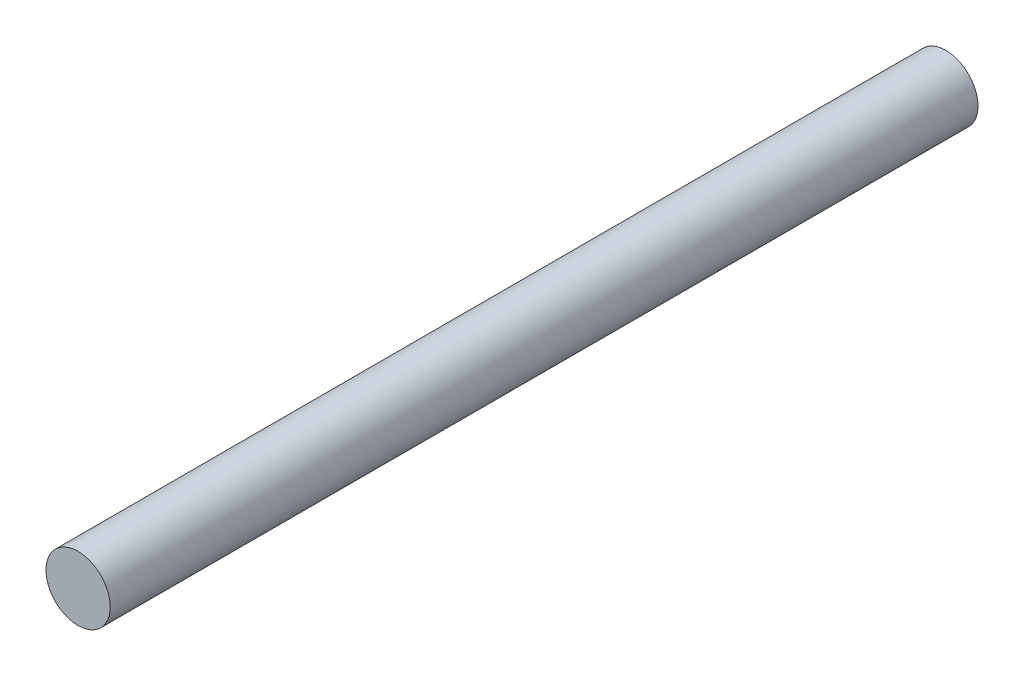
from build123d import *

# Parameters (mm, degrees)
SKETCH1_R           = 25.4
BOSS_EXTRUDE1_DEPTH = 685.8


with BuildPart() as part:
    # Sketch1 → Boss-Extrude1 (new body)
    with BuildSketch(Plane.XY):
        Circle(SKETCH1_R)
    extrude(amount=BOSS_EXTRUDE1_DEPTH)


solid = part.part
